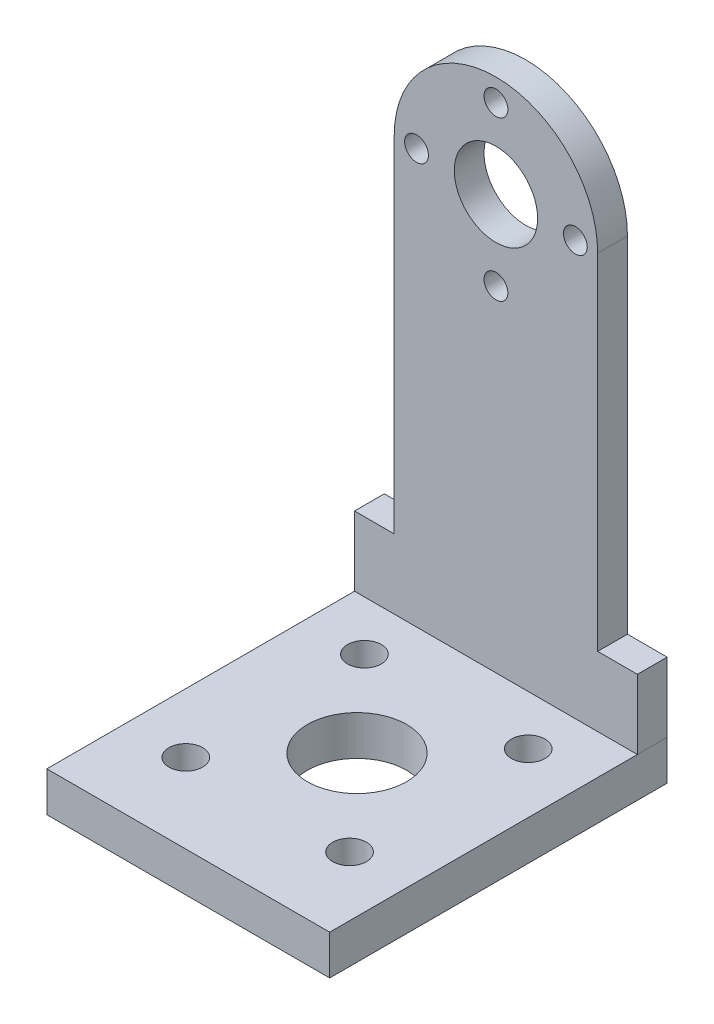
from build123d import *

# Parameters (mm, degrees)
BOSS_EXTRUDE1_DEPTH      = 22
BOSS_EXTRUDE1_DEPTH_BACK = 22
SKETCH1_R                = 1.2
SKETCH1_R_2              = 4.2
SKETCH2_W                = 38
SKETCH2_H                = 20
CUT_EXTRUDE1_DEPTH       = 105.423416914
SKETCH3_W                = 7
SKETCH3_H                = 44
BOSS_EXTRUDE2_DEPTH      = 36
SKETCH5_W                = 34
SKETCH5_H                = 50
CUT_EXTRUDE3_DEPTH       = 109.047443283
SKETCH6_W                = 20.5
SKETCH6_H                = 54.25
CUT_EXTRUDE4_DEPTH       = 111.605436123
SKETCH20_W               = 28.5
SKETCH20_H               = 34
SKETCH20_R               = 1.7
SKETCH20_R_2             = 5
BOSS_EXTRUDE5_DEPTH      = 4
SKETCH21_W               = 3
SKETCH21_H               = 36
CUT_EXTRUDE12_DEPTH      = 66.777085676
SKETCH22_W               = 4
SKETCH22_H               = 25
CUT_EXTRUDE14_DEPTH      = 66.054784605
SKETCH23_W               = 5
SKETCH23_H               = 56
CUT_EXTRUDE15_DEPTH      = 59.21780226
SKETCH24_R               = 1.2
SKETCH24_R_2             = 4.2
BOSS_EXTRUDE8_DEPTH      = 3
CUT_EXTRUDE16_DEPTH      = 57.367654732
CUT_EXTRUDE16_DEPTH_BACK = 57.367654732
SKETCH25_W               = 5
SKETCH25_H               = 56


with BuildPart() as part:
    # Sketch1 → Boss-Extrude1 (new, two sides: drawn at the far end of the back side and taken through both)
    with BuildSketch(Plane.XY.offset(-BOSS_EXTRUDE1_DEPTH_BACK)):
        with BuildLine():
            ThreePointArc((10.25, 0), (0, 10.25), (-10.25, 0))
            Line((-10.25, 0), (-10.25, -100))
            Line((-10.25, -100), (10.25, -100))
            Line((10.25, -100), (10.25, 0))
        make_face()
        with Locations((8, 0)):
            Circle(SKETCH1_R, mode=Mode.SUBTRACT)
        with Locations((0, 8)):
            Circle(SKETCH1_R, mode=Mode.SUBTRACT)
        with Locations((-8, 0)):
            Circle(SKETCH1_R, mode=Mode.SUBTRACT)
        Circle(SKETCH1_R_2, mode=Mode.SUBTRACT)
        with Locations((0, -8)):
            Circle(SKETCH1_R, mode=Mode.SUBTRACT)
    extrude(amount=BOSS_EXTRUDE1_DEPTH + BOSS_EXTRUDE1_DEPTH_BACK)

    # Sketch2 → Cut-Extrude1 (cut, through all)
    with BuildSketch(Plane.ZY.offset(10.25)):
        with Locations((0, 0.25)):
            Rectangle(SKETCH2_W, SKETCH2_H)
    extrude(amount=-CUT_EXTRUDE1_DEPTH, mode=Mode.SUBTRACT)

    # Sketch3 → Boss-Extrude2 (add)
    with BuildSketch(Plane(origin=(0, -9.75, 0), x_dir=(1, 0, 0), z_dir=(0, 1, 0))):
        with Locations((-13.75, 0)):
            Rectangle(SKETCH3_W, SKETCH3_H)
        with Locations((13.75, 0)):
            Rectangle(SKETCH3_W, SKETCH3_H)
    extrude(amount=-BOSS_EXTRUDE2_DEPTH)

    # Sketch5 → Cut-Extrude3 (cut, through all)
    with BuildSketch(Plane.ZY.offset(17.25)):
        with Locations((0, -34.75)):
            Rectangle(SKETCH5_W, SKETCH5_H)
    extrude(amount=-CUT_EXTRUDE3_DEPTH, mode=Mode.SUBTRACT)

    # Sketch6 → Cut-Extrude4 (cut, through all)
    with BuildSketch(Plane.XY.offset(22)):
        with Locations((0, -72.875)):
            Rectangle(SKETCH6_W, SKETCH6_H)
    extrude(amount=-CUT_EXTRUDE4_DEPTH, mode=Mode.SUBTRACT)


with BuildPart() as cut_extrude4_piece_1:
    # of the separate pieces the step leaves, piece 1, a body of its own (cut_extrude4_pieces)
    add(part.part.solids().sort_by_distance((17.25, -45.75, -17))[0])



with BuildPart() as cut_extrude4_piece_2:
    # of the separate pieces the step leaves, piece 2, a body of its own (cut_extrude4_pieces)
    add(part.part.solids().sort_by_distance((-10.25, 0, 22))[0])


with BuildPart() as cut_extrude4_piece_1_1:
    add(cut_extrude4_piece_1.part)

    add(cut_extrude4_piece_2.part)  # Boss-Extrude5 merges Cut-Extrude4 piece 2
    # Sketch20 → Boss-Extrude5 (add)
    with BuildSketch(Plane.XZ.offset(45.75)):
        Rectangle(SKETCH20_W, SKETCH20_H)
        with Locations((-8.25, -9)):
            Circle(SKETCH20_R, mode=Mode.SUBTRACT)
        with Locations((8.25, -9)):
            Circle(SKETCH20_R, mode=Mode.SUBTRACT)
        with Locations((-8.25, 9)):
            Circle(SKETCH20_R, mode=Mode.SUBTRACT)
        Circle(SKETCH20_R_2, mode=Mode.SUBTRACT)
        with Locations((8.25, 9)):
            Circle(SKETCH20_R, mode=Mode.SUBTRACT)
    extrude(amount=-BOSS_EXTRUDE5_DEPTH)

    # Sketch21 → Cut-Extrude12 (cut, through all)
    with BuildSketch(Plane(origin=(0, 0, -22), x_dir=(-1, 0, 0), z_dir=(0, 0, -1))):
        with Locations((-15.75, -27.75)):
            Rectangle(SKETCH21_W, SKETCH21_H)
        with Locations((15.75, -27.75)):
            Rectangle(SKETCH21_W, SKETCH21_H)
    extrude(amount=-CUT_EXTRUDE12_DEPTH, mode=Mode.SUBTRACT)

    # Sketch22 → Cut-Extrude14 (cut, through all)
    with BuildSketch(Plane(origin=(0, 0, -22), x_dir=(-1, 0, 0), z_dir=(0, 0, -1))):
        with Locations((12.25, -22.25)):
            Rectangle(SKETCH22_W, SKETCH22_H)
    extrude(amount=-CUT_EXTRUDE14_DEPTH, mode=Mode.SUBTRACT)

    # Sketch23 → Cut-Extrude15 (cut, through all)
    with BuildSketch(Plane(origin=(14.25, 0, 0), x_dir=(0, 0, -1), z_dir=(1, 0, 0))):
        with Locations((-19.5, -17.75)):
            Rectangle(SKETCH23_W, SKETCH23_H)
    extrude(amount=-CUT_EXTRUDE15_DEPTH, mode=Mode.SUBTRACT)

    # Sketch25 → Cut-Extrude16 (cut, two sides: drawn at the far end of the back side and taken through both)
    with BuildSketch(Plane.ZY.offset(10.25).offset(-CUT_EXTRUDE16_DEPTH_BACK)):
        with Locations((-19.5, -17.75)):
            Rectangle(SKETCH25_W, SKETCH25_H)
    extrude(amount=CUT_EXTRUDE16_DEPTH + CUT_EXTRUDE16_DEPTH_BACK, mode=Mode.SUBTRACT)


with BuildPart() as body_2:
    # Sketch24 → Boss-Extrude8 (new body)
    with BuildSketch(Plane.XY.offset(-17)):
        with BuildLine():
            Line((14.25, -41.75), (14.25, -34.75))
            Line((14.25, -34.75), (10.25, -34.75))
            Line((10.25, -34.75), (10.25, 0))
            ThreePointArc((10.25, 0), (0, 10.25), (-10.25, 0))
            Line((-10.25, 0), (-10.25, -34.75))
            Line((-10.25, -34.75), (-14.25, -34.75))
            Line((-14.25, -34.75), (-14.25, -41.75))
            Line((-14.25, -41.75), (14.25, -41.75))
        make_face()
        with Locations((0, -8)):
            Circle(SKETCH24_R, mode=Mode.SUBTRACT)
        with Locations((-8, 0)):
            Circle(SKETCH24_R, mode=Mode.SUBTRACT)
        Circle(SKETCH24_R_2, mode=Mode.SUBTRACT)
        with Locations((8, 0)):
            Circle(SKETCH24_R, mode=Mode.SUBTRACT)
        with Locations((0, 8)):
            Circle(SKETCH24_R, mode=Mode.SUBTRACT)
    extrude(amount=BOSS_EXTRUDE8_DEPTH)


solid = Compound([cut_extrude4_piece_1_1.part, body_2.part])
